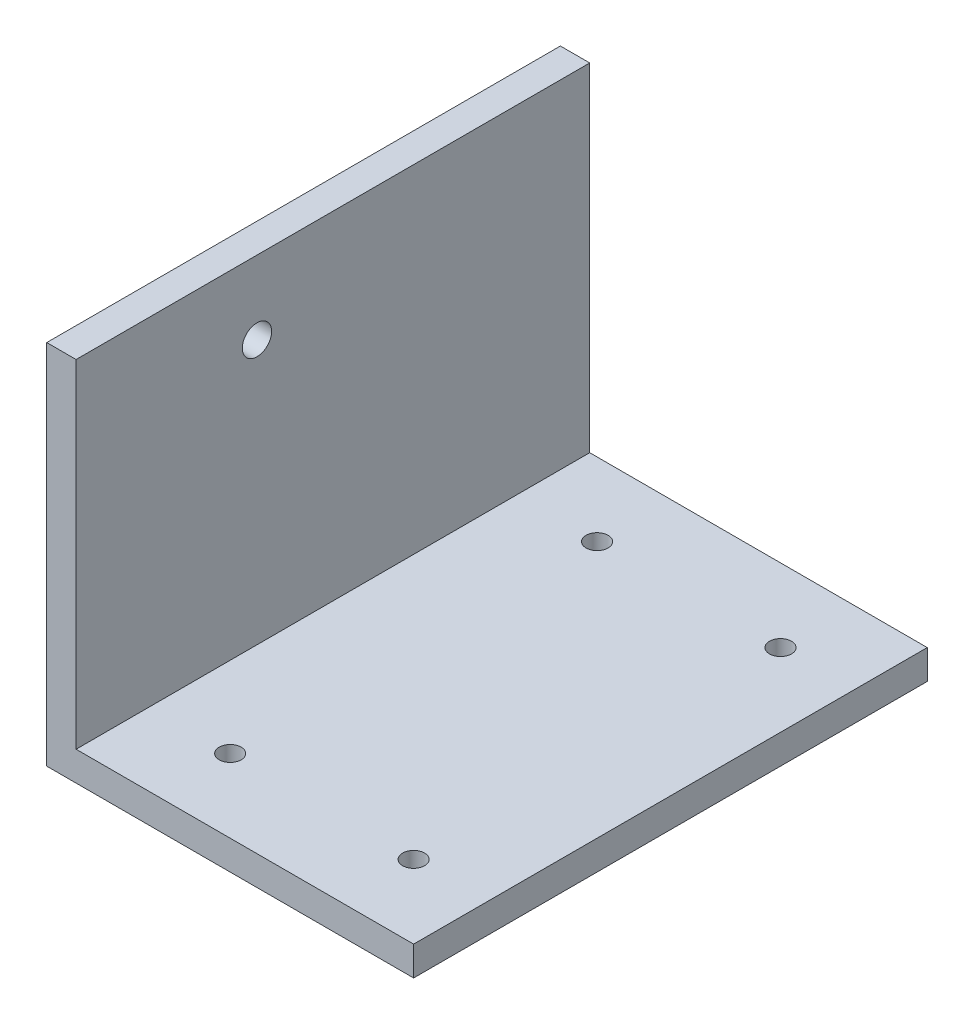
from build123d import *

# Parameters (mm, degrees)
EXTRUSION1_DEPTH                = 70
ESQUISSE2_R                     = 1.5
EXTRUSION2_DEPTH                = 98.549987186
R_P_TITION_LIN_AIRE1_COUNT      = 2
R_P_TITION_LIN_AIRE1_PITCH      = 50
R_P_TITION_LIN_AIRE1_COUNT_DIR2 = 2
R_P_TITION_LIN_AIRE1_PITCH_DIR2 = 25
ESQUISSE3_R                     = 2
ENL_V_MAT_EXTRU_1_DEPTH         = 100.498743711


with BuildPart() as part:
    # Esquisse1 → Extrusion1 (new body)
    with BuildSketch(Plane.XY):
        Polygon((0, 0), (4, 0), (50, 0), (50, 4), (4, 4), (4, 50), (0, 50), align=None)
    extrude(amount=EXTRUSION1_DEPTH)

    # Esquisse2 → Extrusion2 (cut, through all)
    with BuildSketch(Plane(origin=(0, 4, 0), x_dir=(1, 0, 0), z_dir=(0, 1, 0))):
        with Locations(Location((40, -60, 0), (0, 0, 270))):
            Circle(ESQUISSE2_R)
    extrusion2 = extrude(amount=-EXTRUSION2_DEPTH, mode=Mode.SUBTRACT)

    # Répétition linéaire1: Extrusion2 2 × 2
    with Locations(*[(-j * R_P_TITION_LIN_AIRE1_PITCH_DIR2, 0, -i * R_P_TITION_LIN_AIRE1_PITCH) for i in range(R_P_TITION_LIN_AIRE1_COUNT) for j in range(R_P_TITION_LIN_AIRE1_COUNT_DIR2) if (i, j) != (0, 0)]):
        add(extrusion2, mode=Mode.SUBTRACT)

    # Esquisse3 → Enlèv. mat.-Extru.1 (cut, through all)
    with BuildSketch(Plane.ZY):
        with Locations((45.35, 40)):
            Circle(ESQUISSE3_R)
    extrude(amount=-ENL_V_MAT_EXTRU_1_DEPTH, mode=Mode.SUBTRACT)


solid = part.part
